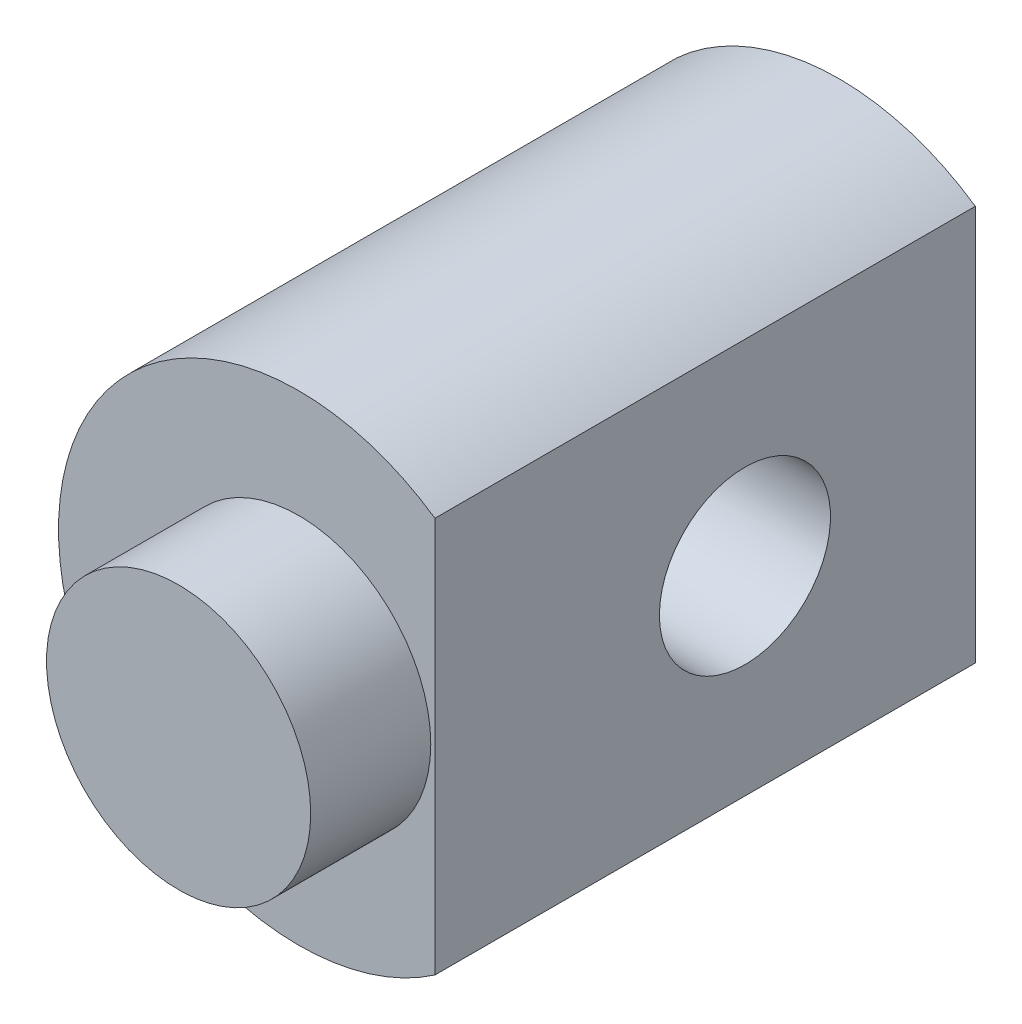
from build123d import *

# Parameters (mm, degrees)
SKETCH1_R           = 11
BOSS_EXTRUDE1_DEPTH = 10
SKETCH2_R           = 20
BOSS_EXTRUDE2_DEPTH = 45
CUT_EXTRUDE1_DEPTH  = 54.150729064
SKETCH5_R           = 7.125
CUT_EXTRUDE2_DEPTH  = 54.150729224
CUT_EXTRUDE3_START  = -45
CUT_EXTRUDE3_DEPTH  = 45


with BuildPart() as part:
    # Sketch1 → Boss-Extrude1 (new body)
    with BuildSketch(Plane.XY):
        Circle(SKETCH1_R)
    extrude(amount=BOSS_EXTRUDE1_DEPTH)

    # Sketch2 → Boss-Extrude2 (add)
    with BuildSketch(Plane(origin=(0, 0, 0), x_dir=(-1, 0, 0), z_dir=(0, 0, -1))):
        with Locations(Location((0, 0, 0), (0, 0, 180))):
            Circle(SKETCH2_R)
    extrude(amount=BOSS_EXTRUDE2_DEPTH)

    # Sketch3 → Cut-Extrude1 (cut, through all)
    with BuildSketch(Plane(origin=(0, 0, 0), x_dir=(0, 0, -1), z_dir=(1, 0, 0))):
        with BuildLine():
            Line((75.441676997, 14.75), (25.441676997, 14.75))
            ThreePointArc((25.441676997, 14.75), (10.816676997, 0.125), (25.441676997, -14.5))
            Line((25.441676997, -14.5), (75.441676997, -14.5))
            Line((75.441676997, -14.5), (75.441676997, 14.75))
        make_face()
    extrude(amount=-CUT_EXTRUDE1_DEPTH, mode=Mode.SUBTRACT)

    # Sketch5 → Cut-Extrude2 (cut, through all)
    with BuildSketch(Plane.ZY):
        with Locations((-25.816676997, 0.125)):
            Circle(SKETCH5_R)
    extrude(amount=-CUT_EXTRUDE2_DEPTH, mode=Mode.SUBTRACT)

    # Sketch6 → Cut-Extrude3 (cut)
    with BuildSketch(Plane(origin=(0, 0, -45), x_dir=(-1, 0, 0), z_dir=(0, 0, -1)).offset(CUT_EXTRUDE3_START)):
        with BuildLine():
            Line((-11.346386998, 16.469957562), (-11.346386998, -16.469957562))
            ThreePointArc((-11.346386998, -16.469957562), (-20, 0), (-11.346386998, 16.469957562))
        make_face()
    extrude(amount=CUT_EXTRUDE3_DEPTH, mode=Mode.SUBTRACT)


solid = part.part
